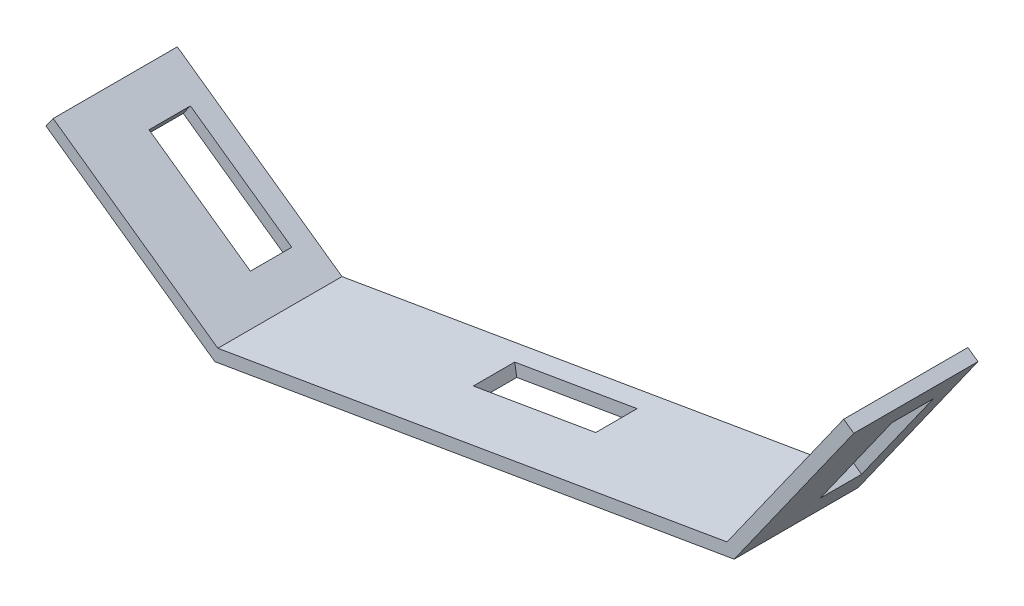
from build123d import *

# Parameters (mm, degrees)
BOSS_EXTRUDE1_DEPTH = 30
SKETCH4_W           = 30
SKETCH4_H           = 10
CUT_EXTRUDE1_DEPTH  = 22
SKETCH5_W           = 30
SKETCH5_H           = 10
CUT_EXTRUDE2_DEPTH  = 22
SKETCH7_W           = 10
SKETCH7_H           = 30
CUT_EXTRUDE3_DEPTH  = 22


with BuildPart() as part:
    # Sketch1 → Boss-Extrude1 (new body)
    with BuildSketch(Plane.XY):
        Polygon((-52.841994179, 15.40272055), (-12.04436597, -13.503222307), (113.43201935, 7.903510096), (142.337962207, 48.701138306), (139.890104514, 50.435494878), (111.702555671, 10.651802523), (-11.323945253, -10.336970601), (-51.107637608, 17.850578242), align=None)
    extrude(amount=BOSS_EXTRUDE1_DEPTH)

    # Sketch4 → Cut-Extrude1 (cut)
    with BuildSketch(Plane(origin=(1.897901103, -11.124620313, 0), x_dir=(0.9857573554860628, 0.16817382705142964, 0), z_dir=(0.1681738270514296, -0.9857573554860627, 0))):
        with Locations((49.500950021, 10)):
            Rectangle(SKETCH4_W, SKETCH4_H)
    extrude(amount=-CUT_EXTRUDE1_DEPTH, mode=Mode.SUBTRACT)

    # Sketch5 → Cut-Extrude2 (cut)
    with BuildSketch(Plane(origin=(-10.395192144, -14.671695242, 0), x_dir=(0.8159525641948715, -0.5781188571425553, 0), z_dir=(-0.5781188571425553, -0.8159525641948715, 0))):
        with Locations((-27.021163849, 10)):
            Rectangle(SKETCH5_W, SKETCH5_H)
    extrude(amount=-CUT_EXTRUDE2_DEPTH, mode=Mode.SUBTRACT)

    # Sketch7 → Cut-Extrude3 (cut)
    with BuildSketch(Plane(origin=(71.792385036, -50.866353523, 0), x_dir=(0, 0, -1), z_dir=(0.8159525641948736, -0.5781188571425522, 0))):
        with Locations((-10, 97.026078719)):
            Rectangle(SKETCH7_W, SKETCH7_H)
    extrude(amount=-CUT_EXTRUDE3_DEPTH, mode=Mode.SUBTRACT)


solid = part.part
